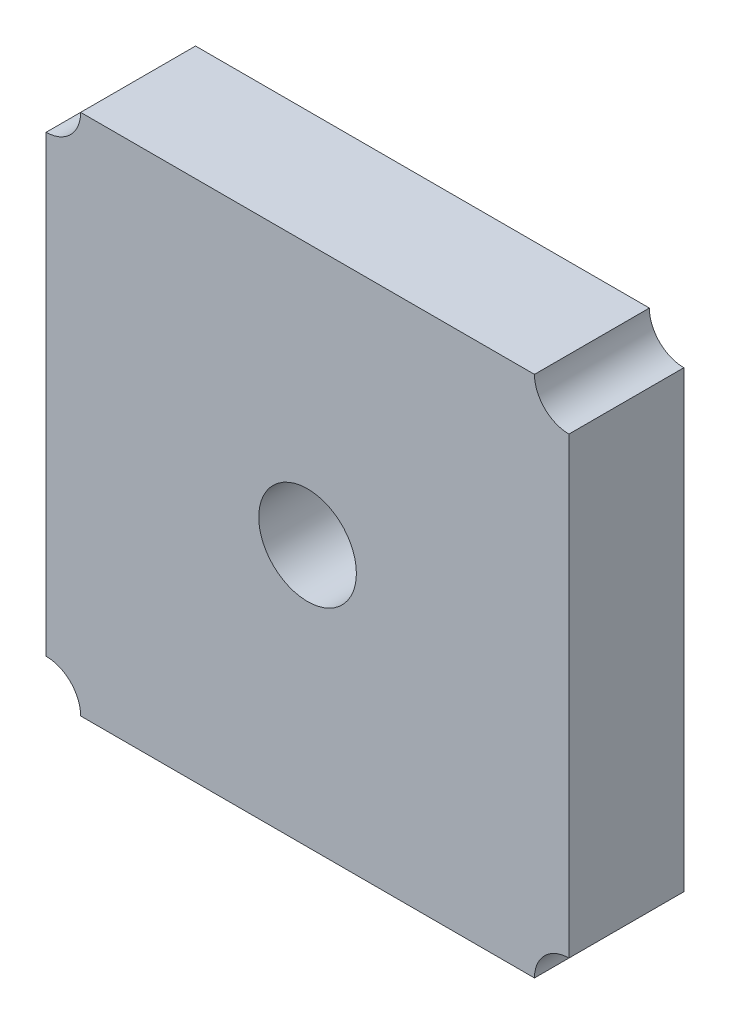
from build123d import *

# Parameters (mm, degrees)
ESQUISSE1_R        = 4.25
BOSS_EXTRU_1_DEPTH = 10


with BuildPart() as part:
    # Esquisse1 → Boss.-Extru.1 (new body)
    with BuildSketch(Plane.XY):
        with BuildLine():
            Line((42.5, 0), (3, 0))
            ThreePointArc((3, 0), (2.121320344, -2.121320344), (0, -3))
            Line((0, -3), (0, -42.5))
            ThreePointArc((0, -42.5), (2.121320344, -43.378679656), (3, -45.5))
            Line((3, -45.5), (42.5, -45.5))
            ThreePointArc((42.5, -45.5), (43.378679656, -43.378679656), (45.5, -42.5))
            Line((45.5, -42.5), (45.5, -3))
            ThreePointArc((45.5, -3), (43.378679656, -2.121320344), (42.5, 0))
        make_face()
        with Locations((22.75, -22.75)):
            Circle(ESQUISSE1_R, mode=Mode.SUBTRACT)
    extrude(amount=BOSS_EXTRU_1_DEPTH)


solid = part.part
